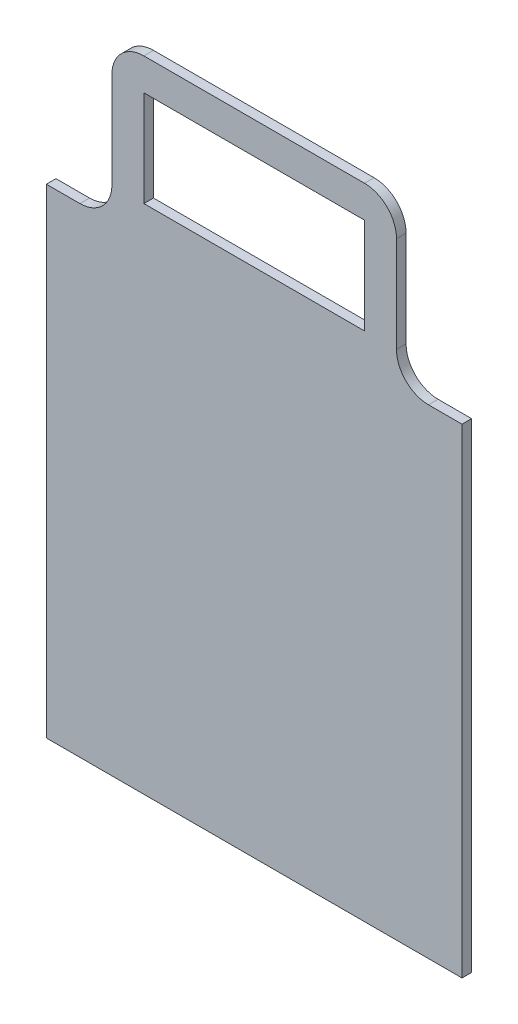
from build123d import *

# Parameters (mm, degrees)
SKETCH1_W           = 69
SKETCH1_H           = 30
BOSS_EXTRUDE1_DEPTH = 3


with BuildPart() as part:
    # Sketch1 → Boss-Extrude1 (new body)
    with BuildSketch(Plane.XY):
        with BuildLine():
            Line((-65, 75), (-54.5, 75))
            ThreePointArc((-54.5, 75), (-47.428932188, 77.928932188), (-44.5, 85))
            Line((-44.5, 85), (-44.5, 115))
            ThreePointArc((-44.5, 115), (-41.571067812, 122.071067812), (-34.5, 125))
            Line((-34.5, 125), (34.5, 125))
            ThreePointArc((34.5, 125), (41.571067812, 122.071067812), (44.5, 115))
            Line((44.5, 115), (44.5, 85))
            ThreePointArc((44.5, 85), (47.428932188, 77.928932188), (54.5, 75))
            Line((54.5, 75), (65, 75))
            Line((65, 75), (65, -75))
            Line((65, -75), (-65, -75))
            Line((-65, -75), (-65, 75))
        make_face()
        with Locations((0, 100)):
            Rectangle(SKETCH1_W, SKETCH1_H, mode=Mode.SUBTRACT)
    extrude(amount=BOSS_EXTRUDE1_DEPTH)


solid = part.part
